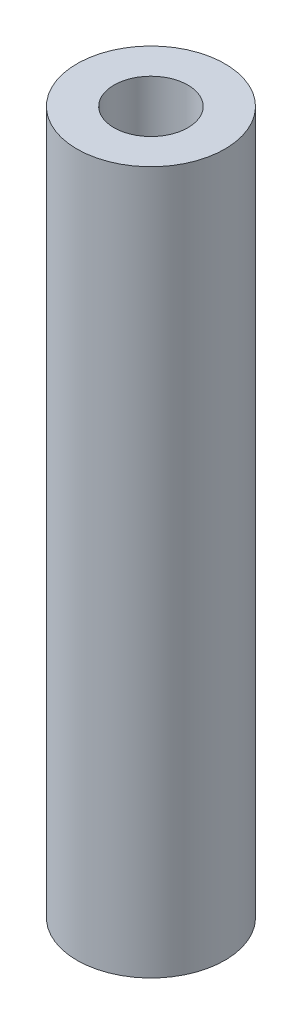
from build123d import *

# Parameters (mm, degrees)
SKETCH1_R           = 2
SKETCH1_R_2         = 1
BOSS_EXTRUDE1_DEPTH = 19
CHAMFER1_SIZE       = 2
CHAMFER1_SIZE2      = 0.727940469


with BuildPart() as part:
    # Sketch1 → Boss-Extrude1 (new body)
    with BuildSketch(Plane(origin=(0, 0, 0), x_dir=(1, 0, 0), z_dir=(0, 1, 0))):
        with Locations(Location((0, 0, 0), (0, 0, 270))):
            Circle(SKETCH1_R)
        with Locations(Location((0, 0, 0), (0, 0, 270))):
            Circle(SKETCH1_R_2, mode=Mode.SUBTRACT)
    extrude(amount=BOSS_EXTRUDE1_DEPTH)

    # Chamfer1
    chamfer1_edges = [part.edges().sort_by_distance(p)[0] for p in [
        (0, 0, -1),
    ]]
    chamfer1_side = [part.faces().sort_by_distance(p)[0] for p in [
        (0, 9.5, -1),
    ]]
    chamfer(chamfer1_edges, length=CHAMFER1_SIZE, length2=CHAMFER1_SIZE2, reference=chamfer1_side[0])


solid = part.part
